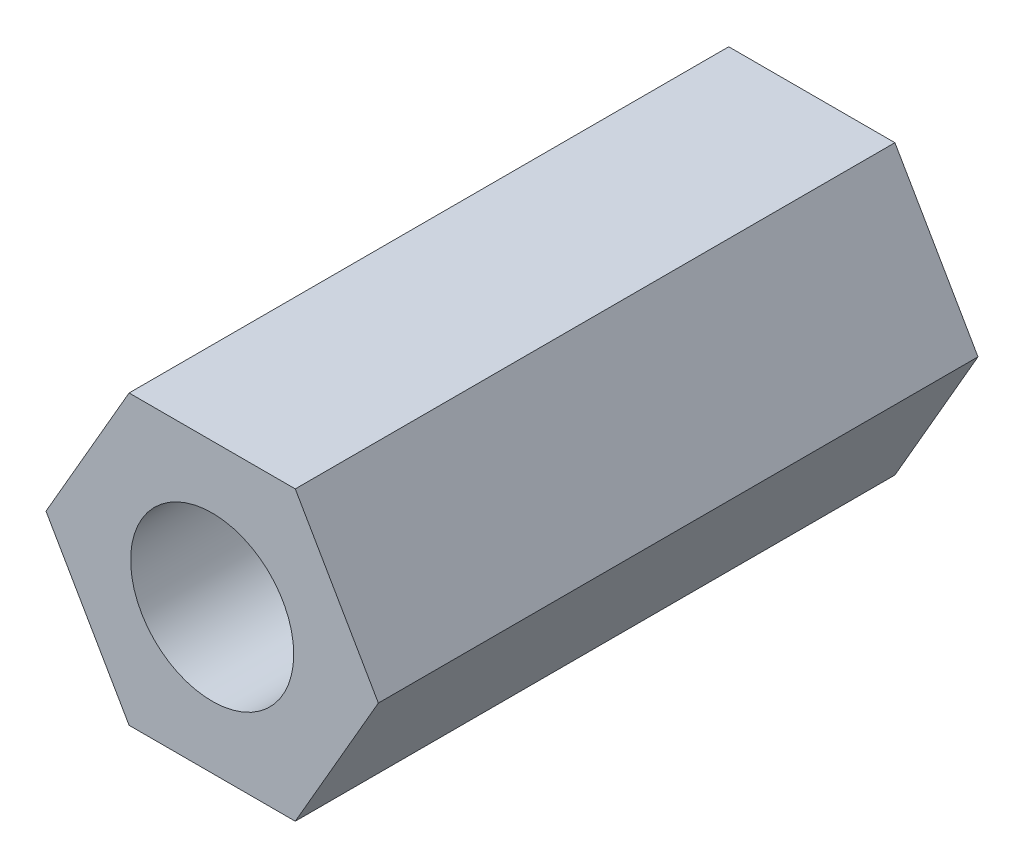
from build123d import *

# Parameters (mm, degrees)
EXTRUDE_1_DEPTH  = 25
HOLE_WIZARD_M8_D = 6.8


with BuildPart() as part:
    # Эскиз1 → Бобышка-Вытянуть1 (new body)
    with BuildSketch(Plane.XY):
        Polygon((6.92820323, 0), (3.464101615, 6), (-3.464101615, 6), (-6.92820323, 0), (-3.464101615, -6), (3.464101615, -6), align=None)
    extrude(amount=-EXTRUDE_1_DEPTH)

    # M8 (through all)
    with Locations(Plane.XY):
        with Locations((0, 0)):
            Hole(HOLE_WIZARD_M8_D / 2)


solid = part.part
